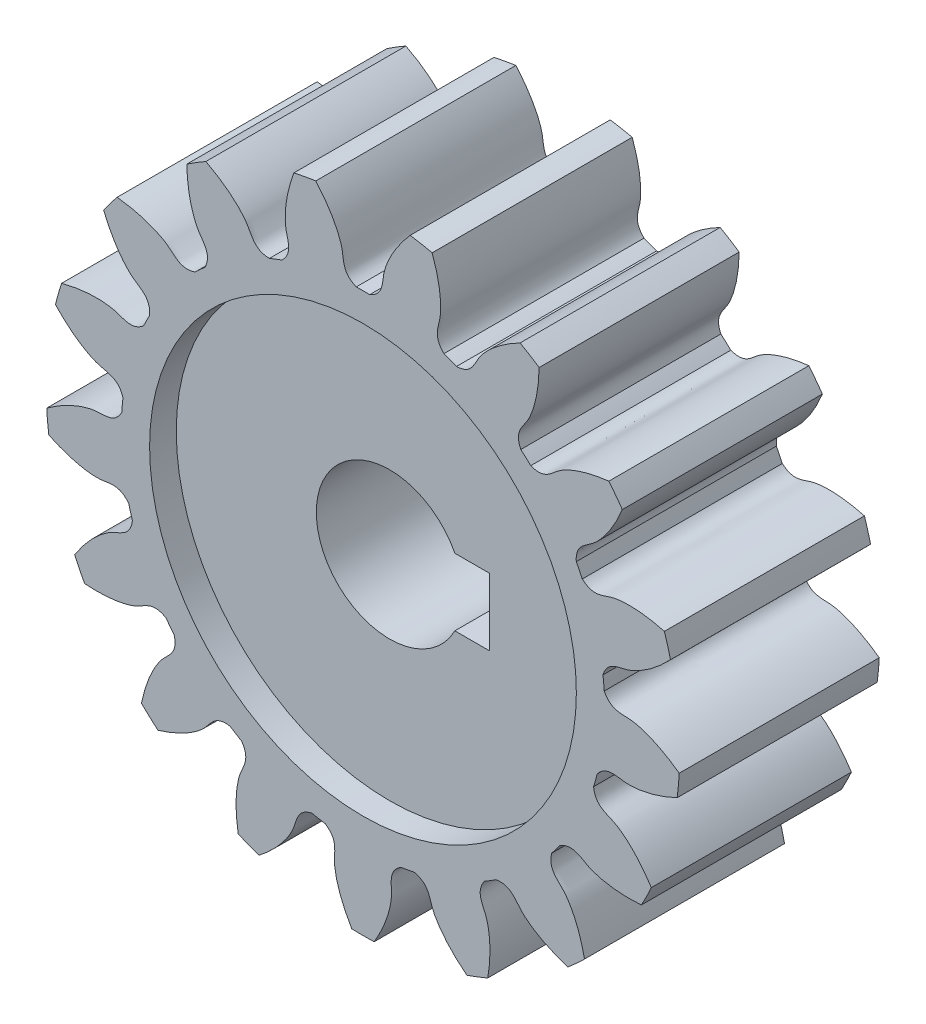
from build123d import *

# Parameters (mm, degrees)
SKETCH_1_R               = 23.75
EXTRUDE_1_DEPTH          = 15
CUT_EXTRUDE_1_DEPTH      = 37.784847424
PATTERN_CIRCULAR_1_COUNT = 17
CUT_EXTRUDE_2_DEPTH      = 37.759909287
SKETCH_5_R               = 16
CUT_EXTRUDE_3_DEPTH      = 2
CUT_EXTRUDE_START        = -2
SKETCH_6_R               = 16
CUT_EXTRUDE_4_DEPTH      = 2


with BuildPart() as part:
    # 草图1 → 凸台-拉伸1 (new body)
    with BuildSketch(Plane.XY):
        Circle(SKETCH_1_R)
    extrude(amount=EXTRUDE_1_DEPTH)

    # 草图2 → 切除-拉伸1 (cut, through all)
    with BuildSketch(Plane.XY):
        with BuildLine():
            ThreePointArc((0.504234368, 18.117984786), (0, 18.125), (-0.504234368, 18.117984786))
            add(Edge.make_bspline(
                [(-0.504234368, 18.117984786), (-1.569699351, 18.562055053), (-1.415488445, 19.387033516), (-1.595764011, 20.162060344), (-1.612439336, 20.227876487), (-1.632546256, 20.301048284), (-1.656376475, 20.381463332), (-1.684229444, 20.468998409), (-1.716397699, 20.563521894), (-1.753171113, 20.664893127), (-1.79483528, 20.772962735), (-1.841671697, 20.887572661), (-1.89395741, 21.008556299), (-1.951964818, 21.135738603), (-2.015961439, 21.268936203), (-2.086209687, 21.407957538), (-2.162966654, 21.552602986), (-2.246483889, 21.702664999), (-2.337007189, 21.85792825), (-2.434776387, 22.018169776), (-2.540025144, 22.183159136), (-2.65298075, 22.352658569), (-2.773863923, 22.526423155), (-2.902888613, 22.704200989), (-3.040261815, 22.885733347), (-3.186183381, 23.070754873), (-3.340845837, 23.258993757), (-3.504434208, 23.450171923), (-3.677125843, 23.644005224), (-3.859090249, 23.840203636), (-4.050488925, 24.038471462), (-4.251475208, 24.238507533), (-4.462194114, 24.44000542), (-4.682782197, 24.642653649), (-4.913367398, 24.846135914), (-5.154068914, 25.050131297), (-5.404997061, 25.254314499), (-5.666253152, 25.458356059), (-5.937929372, 25.661922591), (-6.22010866, 25.864677016), (-6.512864618, 26.066278797), (-6.816261336, 26.266384187), (-7.239554087, 26.533576333), (-7.566442255, 26.726314927), (-7.789114583, 26.851797796)],
                knots=[0, 0, 0, 0, 0.193882922, 0.199023975, 0.204850501, 0.211362501, 0.218559975, 0.226442923, 0.235011345, 0.24426524, 0.254204608, 0.264829451, 0.276139767, 0.288135557, 0.300816821, 0.314183558, 0.328235769, 0.342973453, 0.358396612, 0.374505244, 0.39129935, 0.408778929, 0.426943982, 0.445794509, 0.46533051, 0.485551984, 0.506458932, 0.528051354, 0.550329249, 0.573292619, 0.596941461, 0.621275778, 0.646295568, 0.672000832, 0.69839157, 0.725467781, 0.753229466, 0.781676625, 0.810809257, 0.840627364, 0.871130943, 0.902319997, 0.934194524, 1, 1, 1, 1], degree=3))
            ThreePointArc((-7.789114583, 26.851797796), (0, 27.958707961), (7.789114583, 26.851797796))
            add(Edge.make_bspline(
                [(0.504234368, 18.117984786), (1.569699351, 18.562055053), (1.415488445, 19.387033516), (1.595764011, 20.162060344), (1.612439336, 20.227876487), (1.632546256, 20.301048284), (1.656376475, 20.381463332), (1.684229444, 20.468998409), (1.716397699, 20.563521894), (1.753171113, 20.664893127), (1.79483528, 20.772962735), (1.841671697, 20.887572661), (1.89395741, 21.008556299), (1.951964818, 21.135738603), (2.015961439, 21.268936203), (2.086209687, 21.407957538), (2.162966654, 21.552602986), (2.246483889, 21.702664999), (2.337007189, 21.85792825), (2.434776387, 22.018169776), (2.540025144, 22.183159136), (2.65298075, 22.352658569), (2.773863923, 22.526423155), (2.902888613, 22.704200989), (3.040261815, 22.885733347), (3.186183381, 23.070754873), (3.340845837, 23.258993757), (3.504434208, 23.450171923), (3.677125843, 23.644005224), (3.859090249, 23.840203636), (4.050488925, 24.038471462), (4.251475208, 24.238507533), (4.462194114, 24.44000542), (4.682782197, 24.642653649), (4.913367398, 24.846135914), (5.154068914, 25.050131297), (5.404997061, 25.254314499), (5.666253152, 25.458356059), (5.937929372, 25.661922591), (6.22010866, 25.864677016), (6.512864618, 26.066278797), (6.816261336, 26.266384187), (7.239554087, 26.533576333), (7.566442255, 26.726314927), (7.789114583, 26.851797796)],
                knots=[0, 0, 0, 0, 0.193882922, 0.199023975, 0.204850501, 0.211362501, 0.218559975, 0.226442923, 0.235011345, 0.24426524, 0.254204608, 0.264829451, 0.276139767, 0.288135557, 0.300816821, 0.314183558, 0.328235769, 0.342973453, 0.358396612, 0.374505244, 0.39129935, 0.408778929, 0.426943982, 0.445794509, 0.46533051, 0.485551984, 0.506458932, 0.528051354, 0.550329249, 0.573292619, 0.596941461, 0.621275778, 0.646295568, 0.672000832, 0.69839157, 0.725467781, 0.753229466, 0.781676625, 0.810809257, 0.840627364, 0.871130943, 0.902319997, 0.934194524, 1, 1, 1, 1], degree=3))
        make_face()
    cut_extrude_1 = extrude(amount=CUT_EXTRUDE_1_DEPTH, mode=Mode.SUBTRACT)

    # 阵列(圆周)1: 切除-拉伸1 ×17 about axis
    pattern_circular_1_axis = Axis((0, 0, 15), (0, 0, -1))
    for i in range(1, PATTERN_CIRCULAR_1_COUNT):
        add(cut_extrude_1.rotate(pattern_circular_1_axis, i * 360 / PATTERN_CIRCULAR_1_COUNT), mode=Mode.SUBTRACT)

    # 草图4 → 切除-拉伸2 (cut, through all)
    with BuildSketch(Plane.XY.offset(15)):
        with BuildLine():
            Line((4.889566267, 2.518360919), (7.5, 2.518360919))
            Line((7.5, 2.518360919), (7.5, -2.518360919))
            Line((7.5, -2.518360919), (4.889566267, -2.518360919))
            ThreePointArc((4.889566267, -2.518360919), (-5.5, 0), (4.889566267, 2.518360919))
        make_face()
    extrude(amount=-CUT_EXTRUDE_2_DEPTH, mode=Mode.SUBTRACT)

    # 草图5 → 切除-拉伸3 (cut)
    with BuildSketch(Plane.XY.offset(15)):
        Circle(SKETCH_5_R)
    extrude(amount=-CUT_EXTRUDE_3_DEPTH, mode=Mode.SUBTRACT)

    # 草图6 → 切除-拉伸4 (cut)
    with BuildSketch(Plane(origin=(0, 0, 0), x_dir=(-1, 0, 0), z_dir=(0, 0, -1)).offset(CUT_EXTRUDE_START)):
        Circle(SKETCH_6_R)
    extrude(amount=CUT_EXTRUDE_4_DEPTH, mode=Mode.SUBTRACT)


solid = part.part
